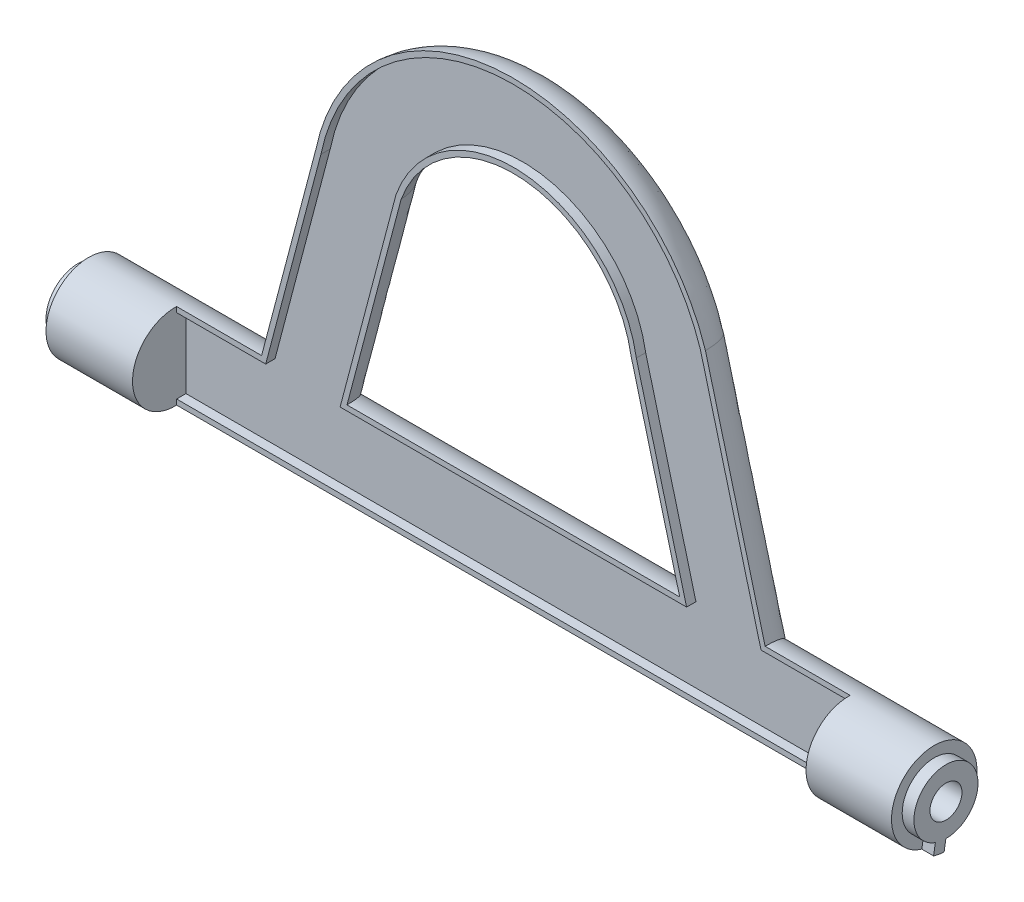
from build123d import *
from build123d.topology import SkipClean

# Parameters (mm, degrees)
SCHIZZO1_R                    = 4
ESTRUSIONE_ESTRUSIONE1_DEPTH  = 40.625
SCHIZZO3_R                    = 4
TAGLIO_ESTRUSIONE1_START      = 40.625
TAGLIO_ESTRUSIONE1_DEPTH      = 1.1
TAGLIO_ESTRUSIONE2_START      = -39.625
TAGLIO_ESTRUSIONE2_DEPTH      = 1
TAGLIO_ESTRUSIONE3_START      = -40.625
SCHIZZO6_R                    = 1.5
TAGLIO_ESTRUSIONE3_DEPTH      = 6
TAGLIO_ESTRUSIONE4_START      = 34.625
SCHIZZO7_R                    = 1.5
TAGLIO_ESTRUSIONE4_DEPTH      = 6
TAGLIO_ESTRUSIONE5_START      = 5
TAGLIO_ESTRUSIONE5_DEPTH      = 6
TAGLIO_ESTRUSIONE7_DEPTH      = 56.95924295
TAGLIO_ESTRUSIONE7_DEPTH_BACK = 56.95924295
SCHIZZO9_W                    = 63.05
SCHIZZO9_H                    = 4.127016654


with BuildPart() as part:
    # Schizzo1 → Estrusione-Estrusione1 (new, symmetric)
    with BuildSketch(Plane(origin=(0, 0, 0), x_dir=(0, 0, -1), z_dir=(1, 0, 0))):
        Circle(SCHIZZO1_R)
    extrude(amount=ESTRUSIONE_ESTRUSIONE1_DEPTH, both=True)

    # Sweep1: sweep along a path in Schizzo2
    with BuildLine(Plane.XY) as sweep1_path:
        Line((-20.625, 0), (-14.503941276, 23.206306042))
        ThreePointArc((-14.503941276, 23.206306042), (0, 34.380644339), (14.503941276, 23.206306042))
        Line((14.503941276, 23.206306042), (20.625, 0))
    # Schizzo3 → Sweep1 (sweep)
    with BuildSketch(Plane(origin=(0, 0, 0), x_dir=(1, 0, 0), z_dir=(0, 1, 0))):
        with Locations((-20.625, 0)):
            Circle(SCHIZZO3_R)
    sweep(path=sweep1_path.line)

    # Schizzo4 → Taglio-Estrusione1 (cut)
    with BuildSketch(Plane(origin=(0, 0, 0), x_dir=(0, 0, -1), z_dir=(1, 0, 0)).offset(TAGLIO_ESTRUSIONE1_START)):
        with BuildLine():
            ThreePointArc((-0.009903808, -2.999983652), (0.509762562, 2.956373138), (-0.995361521, -2.830062798))
            Line((-0.995361521, -2.830062798), (-1.16, -3.828106582))
            ThreePointArc((-1.16, -3.828106582), (0.672388498, 3.943081753), (-0.174229562, -3.996203706))
            Line((-0.174229562, -3.996203706), (-0.009903808, -2.999983652))
        make_face()
    extrude(amount=-TAGLIO_ESTRUSIONE1_DEPTH, mode=Mode.SUBTRACT)

    # Schizzo5 → Taglio-Estrusione2 (cut)
    with BuildSketch(Plane(origin=(0, 0, 0), x_dir=(0, 0, -1), z_dir=(1, 0, 0)).offset(TAGLIO_ESTRUSIONE2_START)):
        with BuildLine():
            Line((-1.16, -3.828106582), (-0.995361521, -2.830062798))
            ThreePointArc((-0.995361521, -2.830062798), (0.509762562, 2.956373138), (-0.009903808, -2.999983652))
            Line((-0.009903808, -2.999983652), (-0.174229562, -3.996203706))
            ThreePointArc((-0.174229562, -3.996203706), (0.672388498, 3.943081753), (-1.16, -3.828106582))
        make_face()
    extrude(amount=-TAGLIO_ESTRUSIONE2_DEPTH, mode=Mode.SUBTRACT)

    # Schizzo6 → Taglio-Estrusione3 (cut)
    with BuildSketch(Plane(origin=(0, 0, 0), x_dir=(0, 0, -1), z_dir=(1, 0, 0)).offset(TAGLIO_ESTRUSIONE3_START)):
        Circle(SCHIZZO6_R)
    extrude(amount=TAGLIO_ESTRUSIONE3_DEPTH, mode=Mode.SUBTRACT)

    # Schizzo7 → Taglio-Estrusione4 (cut)
    with BuildSketch(Plane(origin=(0, 0, 0), x_dir=(0, 0, -1), z_dir=(1, 0, 0)).offset(TAGLIO_ESTRUSIONE4_START)):
        Circle(SCHIZZO7_R)
    extrude(amount=TAGLIO_ESTRUSIONE4_DEPTH, mode=Mode.SUBTRACT)

    # Schizzo8 → Taglio-Estrusione5 (cut)
    with SkipClean():  # the faces are left unmerged after this step: merging them gives an invalid solid
        with BuildSketch(Plane.XY.offset(TAGLIO_ESTRUSIONE5_START)):
            with BuildLine():
                Line((-31.525, -3.5), (31.525, -3.5))
                Line((31.525, -3.5), (31.525, 3.5))
                Line((31.525, 3.5), (23.184714524, 3.5))
                Line((23.184714524, 3.5), (23.086467119, 3.872477943))
                Line((23.086467119, 3.872477943), (17.503564721, 25.038512689))
                ThreePointArc((17.503564721, 25.038512689), (-1.006578206, 37.748362013), (-18.017008414, 23.091932531))
                Line((-18.017008414, 23.091932531), (-23.086467119, 3.872477943))
                Line((-23.086467119, 3.872477943), (-23.184714524, 3.5))
                Line((-23.184714524, 3.5), (-31.525, 3.5))
                Line((-31.525, 3.5), (-31.525, -3.5))
            make_face()
            with BuildLine():
                Line((-16.053396537, 4.127522057), (-10.981638972, 23.355692138))
                ThreePointArc((-10.981638972, 23.355692138), (1.042788279, 31.012926666), (11.513552997, 21.339086809))
                Line((11.513552997, 21.339086809), (16.053396537, 4.127522057))
                Line((16.053396537, 4.127522057), (16.218916174, 3.5))
                Line((16.218916174, 3.5), (-16.218916174, 3.5))
                Line((-16.218916174, 3.5), (-16.053396537, 4.127522057))
            make_face(mode=Mode.SUBTRACT)
        extrude(amount=-TAGLIO_ESTRUSIONE5_DEPTH, mode=Mode.SUBTRACT)

    # Schizzo9 → Taglio-Estrusione7 (cut, two sides: drawn at the far end of the back side and taken through both)
    with BuildSketch(Plane(origin=(0, 0, 0), x_dir=(1, 0, 0), z_dir=(0, 1, 0)).offset(-TAGLIO_ESTRUSIONE7_DEPTH_BACK)):
        with Locations((0, -1.936491673)):
            Rectangle(SCHIZZO9_W, SCHIZZO9_H)
    extrude(amount=TAGLIO_ESTRUSIONE7_DEPTH + TAGLIO_ESTRUSIONE7_DEPTH_BACK, mode=Mode.SUBTRACT)


solid = part.part
